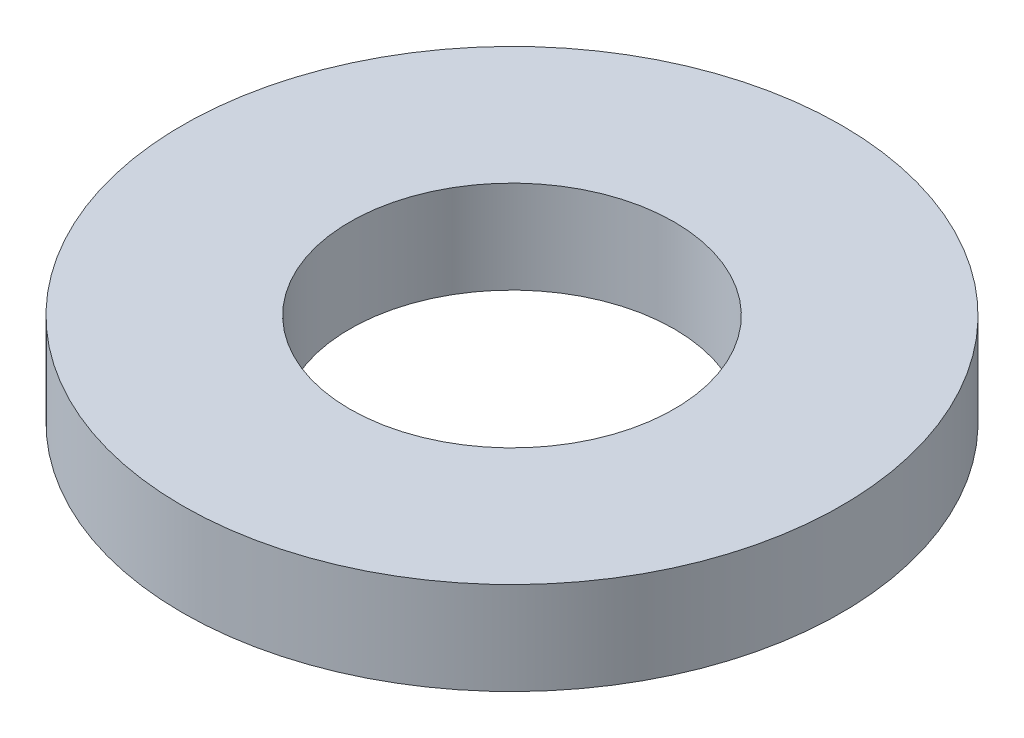
from build123d import *

# Parameters (mm, degrees)
SKETCH1_R           = 28.45
BOSS_EXTRUDE1_DEPTH = 8
SKETCH2_R           = 14
CUT_EXTRUDE1_DEPTH  = 42.022006289


with BuildPart() as part:
    # Sketch1 → Boss-Extrude1 (new body)
    with BuildSketch(Plane(origin=(0, 0, 0), x_dir=(1, 0, 0), z_dir=(0, 1, 0))):
        with Locations(Location((0, 0, 0), (0, 0, 270))):
            Circle(SKETCH1_R)
    extrude(amount=BOSS_EXTRUDE1_DEPTH)

    # Sketch2 → Cut-Extrude1 (cut, through all)
    with BuildSketch(Plane(origin=(0, 8, 0), x_dir=(1, 0, 0), z_dir=(0, 1, 0))):
        with Locations(Location((0, 0, 0), (0, 0, 270))):
            Circle(SKETCH2_R)
    extrude(amount=-CUT_EXTRUDE1_DEPTH, mode=Mode.SUBTRACT)


solid = part.part
